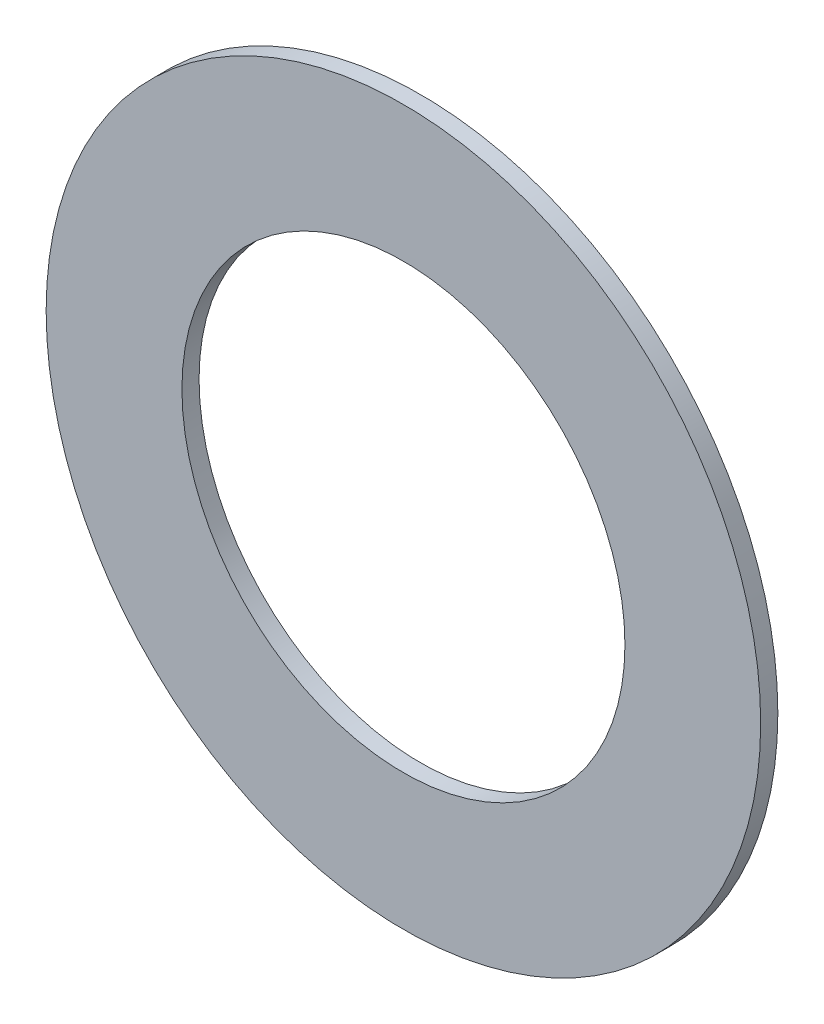
from build123d import *

# Parameters (mm, degrees)
SKETCH1_R           = 63.5
SKETCH1_R_2         = 39.37
BOSS_EXTRUDE1_DEPTH = 3.048


with BuildPart() as part:
    # Sketch1 → Boss-Extrude1 (new body)
    with BuildSketch(Plane.XY):
        with Locations(Location((0, 0, 0), (0, 0, 180))):
            Circle(SKETCH1_R)
        with Locations(Location((0, 0, 0), (0, 0, 180))):
            Circle(SKETCH1_R_2, mode=Mode.SUBTRACT)
    extrude(amount=BOSS_EXTRUDE1_DEPTH)


solid = part.part
